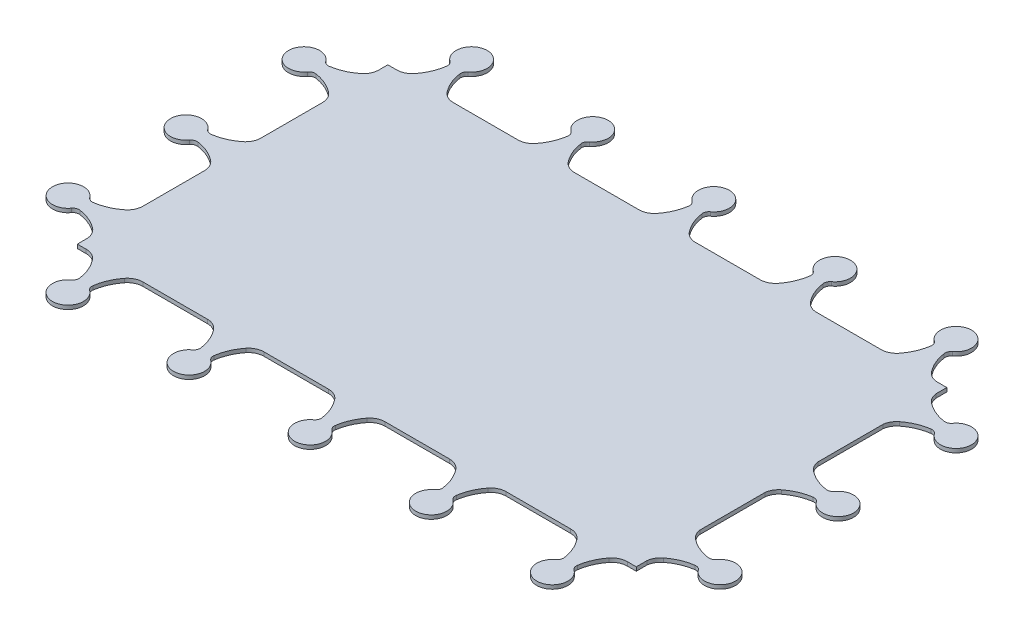
from build123d import *

# Parameters (mm, degrees)
BOSS_EXTRUDE1_DEPTH  = 3.175
BOSS_EXTRUDE2_DEPTH  = 3.175
LPATTERN1_COUNT      = 5
LPATTERN1_PITCH      = 99.06
MIRROR1_COPY_1_DEPTH = 3.175
MIRROR1_COPY_2_DEPTH = 3.175
MIRROR1_COPY_3_DEPTH = 3.175
MIRROR1_COPY_4_DEPTH = 3.175
BOSS_EXTRUDE3_DEPTH  = 3.175
LPATTERN2_COUNT      = 3
LPATTERN2_PITCH      = 96.52
MIRROR2_COPY_1_DEPTH = 3.175
MIRROR2_COPY_2_DEPTH = 3.175


with BuildPart() as part:
    # Sketch1 → Boss-Extrude1 (new body)
    with BuildSketch(Plane(origin=(0, 0, 0), x_dir=(1, 0, 0), z_dir=(0, 1, 0))):
        Polygon((0, 200.406867622), (0, 0), (457.2, 0), (457.2, 254), (53.593132378, 254), (7.268244995, 254), (0, 254), (0, 246.731755005), align=None)
    extrude(amount=BOSS_EXTRUDE1_DEPTH)

    # Sketch1<3> → Boss-Extrude2 (add)
    with BuildSketch(Plane(origin=(0, 0, 0), x_dir=(1, 0, 0), z_dir=(0, 1, 0))):
        with BuildLine():
            Line((7.268244995, 254), (53.593132378, 254))
            ThreePointArc((53.593132378, 254), (48.043028868, 255.276937756), (43.609009881, 258.850968343))
            ThreePointArc((43.609009881, 258.850968343), (38.533476821, 267.409528266), (35.84709227, 276.990411412))
            ThreePointArc((35.84709227, 276.990411412), (36.197138958, 279.690776765), (37.891385065, 281.82245119))
            ThreePointArc((37.891385065, 281.82245119), (30.430688687, 304.8), (22.969992308, 281.82245119))
            ThreePointArc((22.969992308, 281.82245119), (24.664238415, 279.690776765), (25.014285104, 276.990411412))
            ThreePointArc((25.014285104, 276.990411412), (22.327900553, 267.409528266), (17.252367493, 258.850968343))
            ThreePointArc((17.252367493, 258.850968343), (12.818348506, 255.276937756), (7.268244995, 254))
        make_face()
    boss_extrude2 = extrude(amount=BOSS_EXTRUDE2_DEPTH)

    # LPattern1: Boss-Extrude2 ×5
    with Locations(*[(i * LPATTERN1_PITCH, 0, 0) for i in range(1, LPATTERN1_COUNT)]):
        add(boss_extrude2)

    # Mirror1: Boss-Extrude2 across plane
    add(boss_extrude2.mirror(Plane.XY.offset(-127)))

    # Mirror1 copy 1 sketch → Mirror1 copy 1 (add)
    with BuildSketch(Plane(origin=(99.06, 0, -254), x_dir=(1, 0, 0), z_dir=(0, 1, 0))):
        with BuildLine():
            Line((7.268244995, -254), (53.593132378, -254))
            ThreePointArc((53.593132378, -254), (48.043028868, -255.276937756), (43.609009881, -258.850968343))
            ThreePointArc((43.609009881, -258.850968343), (38.533476821, -267.409528266), (35.84709227, -276.990411412))
            ThreePointArc((35.84709227, -276.990411412), (36.197138958, -279.690776765), (37.891385065, -281.82245119))
            ThreePointArc((37.891385065, -281.82245119), (30.430688687, -304.8), (22.969992308, -281.82245119))
            ThreePointArc((22.969992308, -281.82245119), (24.664238415, -279.690776765), (25.014285104, -276.990411412))
            ThreePointArc((25.014285104, -276.990411412), (22.327900553, -267.409528266), (17.252367493, -258.850968343))
            ThreePointArc((17.252367493, -258.850968343), (12.818348506, -255.276937756), (7.268244995, -254))
        make_face()
    extrude(amount=MIRROR1_COPY_1_DEPTH)

    # Mirror1 copy 2 sketch → Mirror1 copy 2 (add)
    with BuildSketch(Plane(origin=(198.12, 0, -254), x_dir=(1, 0, 0), z_dir=(0, 1, 0))):
        with BuildLine():
            Line((7.268244995, -254), (53.593132378, -254))
            ThreePointArc((53.593132378, -254), (48.043028868, -255.276937756), (43.609009881, -258.850968343))
            ThreePointArc((43.609009881, -258.850968343), (38.533476821, -267.409528266), (35.84709227, -276.990411412))
            ThreePointArc((35.84709227, -276.990411412), (36.197138958, -279.690776765), (37.891385065, -281.82245119))
            ThreePointArc((37.891385065, -281.82245119), (30.430688687, -304.8), (22.969992308, -281.82245119))
            ThreePointArc((22.969992308, -281.82245119), (24.664238415, -279.690776765), (25.014285104, -276.990411412))
            ThreePointArc((25.014285104, -276.990411412), (22.327900553, -267.409528266), (17.252367493, -258.850968343))
            ThreePointArc((17.252367493, -258.850968343), (12.818348506, -255.276937756), (7.268244995, -254))
        make_face()
    extrude(amount=MIRROR1_COPY_2_DEPTH)

    # Mirror1 copy 3 sketch → Mirror1 copy 3 (add)
    with BuildSketch(Plane(origin=(297.18, 0, -254), x_dir=(1, 0, 0), z_dir=(0, 1, 0))):
        with BuildLine():
            Line((7.268244995, -254), (53.593132378, -254))
            ThreePointArc((53.593132378, -254), (48.043028868, -255.276937756), (43.609009881, -258.850968343))
            ThreePointArc((43.609009881, -258.850968343), (38.533476821, -267.409528266), (35.84709227, -276.990411412))
            ThreePointArc((35.84709227, -276.990411412), (36.197138958, -279.690776765), (37.891385065, -281.82245119))
            ThreePointArc((37.891385065, -281.82245119), (30.430688687, -304.8), (22.969992308, -281.82245119))
            ThreePointArc((22.969992308, -281.82245119), (24.664238415, -279.690776765), (25.014285104, -276.990411412))
            ThreePointArc((25.014285104, -276.990411412), (22.327900553, -267.409528266), (17.252367493, -258.850968343))
            ThreePointArc((17.252367493, -258.850968343), (12.818348506, -255.276937756), (7.268244995, -254))
        make_face()
    extrude(amount=MIRROR1_COPY_3_DEPTH)

    # Mirror1 copy 4 sketch → Mirror1 copy 4 (add)
    with BuildSketch(Plane(origin=(396.24, 0, -254), x_dir=(1, 0, 0), z_dir=(0, 1, 0))):
        with BuildLine():
            Line((7.268244995, -254), (53.593132378, -254))
            ThreePointArc((53.593132378, -254), (48.043028868, -255.276937756), (43.609009881, -258.850968343))
            ThreePointArc((43.609009881, -258.850968343), (38.533476821, -267.409528266), (35.84709227, -276.990411412))
            ThreePointArc((35.84709227, -276.990411412), (36.197138958, -279.690776765), (37.891385065, -281.82245119))
            ThreePointArc((37.891385065, -281.82245119), (30.430688687, -304.8), (22.969992308, -281.82245119))
            ThreePointArc((22.969992308, -281.82245119), (24.664238415, -279.690776765), (25.014285104, -276.990411412))
            ThreePointArc((25.014285104, -276.990411412), (22.327900553, -267.409528266), (17.252367493, -258.850968343))
            ThreePointArc((17.252367493, -258.850968343), (12.818348506, -255.276937756), (7.268244995, -254))
        make_face()
    extrude(amount=MIRROR1_COPY_4_DEPTH)

    # Sketch1<4> → Boss-Extrude3 (add)
    with BuildSketch(Plane(origin=(0, 0, 0), x_dir=(1, 0, 0), z_dir=(0, 1, 0))):
        with BuildLine():
            ThreePointArc((-4.850968343, 210.390990119), (-1.276937756, 205.956971132), (0, 200.406867622))
            Line((0, 200.406867622), (0, 246.731755005))
            ThreePointArc((0, 246.731755005), (-1.276937756, 241.181651494), (-4.850968343, 236.747632507))
            ThreePointArc((-4.850968343, 236.747632507), (-13.409528266, 231.672099447), (-22.990411412, 228.985714896))
            ThreePointArc((-22.990411412, 228.985714896), (-25.690776765, 229.335761585), (-27.82245119, 231.030007692))
            ThreePointArc((-27.82245119, 231.030007692), (-50.8, 223.569311313), (-27.82245119, 216.108614935))
            ThreePointArc((-27.82245119, 216.108614935), (-25.690776765, 217.802861042), (-22.990411412, 218.15290773))
            ThreePointArc((-22.990411412, 218.15290773), (-13.409528266, 215.466523179), (-4.850968343, 210.390990119))
        make_face()
    boss_extrude3 = extrude(amount=BOSS_EXTRUDE3_DEPTH)

    # LPattern2: Boss-Extrude3 ×3
    with Locations(*[(0, 0, i * LPATTERN2_PITCH) for i in range(1, LPATTERN2_COUNT)]):
        add(boss_extrude3)

    # Mirror2: Boss-Extrude3 across plane
    add(boss_extrude3.mirror(Plane(origin=(228.550688687, 0, 0), x_dir=(0, 0, 1), z_dir=(1, 0, 0))))

    # Mirror2 copy 1 sketch → Mirror2 copy 1 (add)
    with BuildSketch(Plane(origin=(457.101377374, 0, 96.52), x_dir=(-1, 0, 0), z_dir=(0, 1, 0))):
        with BuildLine():
            ThreePointArc((-4.850968343, -210.390990119), (-1.276937756, -205.956971132), (0, -200.406867622))
            Line((0, -200.406867622), (0, -246.731755005))
            ThreePointArc((0, -246.731755005), (-1.276937756, -241.181651494), (-4.850968343, -236.747632507))
            ThreePointArc((-4.850968343, -236.747632507), (-13.409528266, -231.672099447), (-22.990411412, -228.985714896))
            ThreePointArc((-22.990411412, -228.985714896), (-25.690776765, -229.335761585), (-27.82245119, -231.030007692))
            ThreePointArc((-27.82245119, -231.030007692), (-50.8, -223.569311313), (-27.82245119, -216.108614935))
            ThreePointArc((-27.82245119, -216.108614935), (-25.690776765, -217.802861042), (-22.990411412, -218.15290773))
            ThreePointArc((-22.990411412, -218.15290773), (-13.409528266, -215.466523179), (-4.850968343, -210.390990119))
        make_face()
    extrude(amount=MIRROR2_COPY_1_DEPTH)

    # Mirror2 copy 2 sketch → Mirror2 copy 2 (add)
    with BuildSketch(Plane(origin=(457.101377374, 0, 193.04), x_dir=(-1, 0, 0), z_dir=(0, 1, 0))):
        with BuildLine():
            ThreePointArc((-4.850968343, -210.390990119), (-1.276937756, -205.956971132), (0, -200.406867622))
            Line((0, -200.406867622), (0, -246.731755005))
            ThreePointArc((0, -246.731755005), (-1.276937756, -241.181651494), (-4.850968343, -236.747632507))
            ThreePointArc((-4.850968343, -236.747632507), (-13.409528266, -231.672099447), (-22.990411412, -228.985714896))
            ThreePointArc((-22.990411412, -228.985714896), (-25.690776765, -229.335761585), (-27.82245119, -231.030007692))
            ThreePointArc((-27.82245119, -231.030007692), (-50.8, -223.569311313), (-27.82245119, -216.108614935))
            ThreePointArc((-27.82245119, -216.108614935), (-25.690776765, -217.802861042), (-22.990411412, -218.15290773))
            ThreePointArc((-22.990411412, -218.15290773), (-13.409528266, -215.466523179), (-4.850968343, -210.390990119))
        make_face()
    extrude(amount=MIRROR2_COPY_2_DEPTH)


solid = part.part
